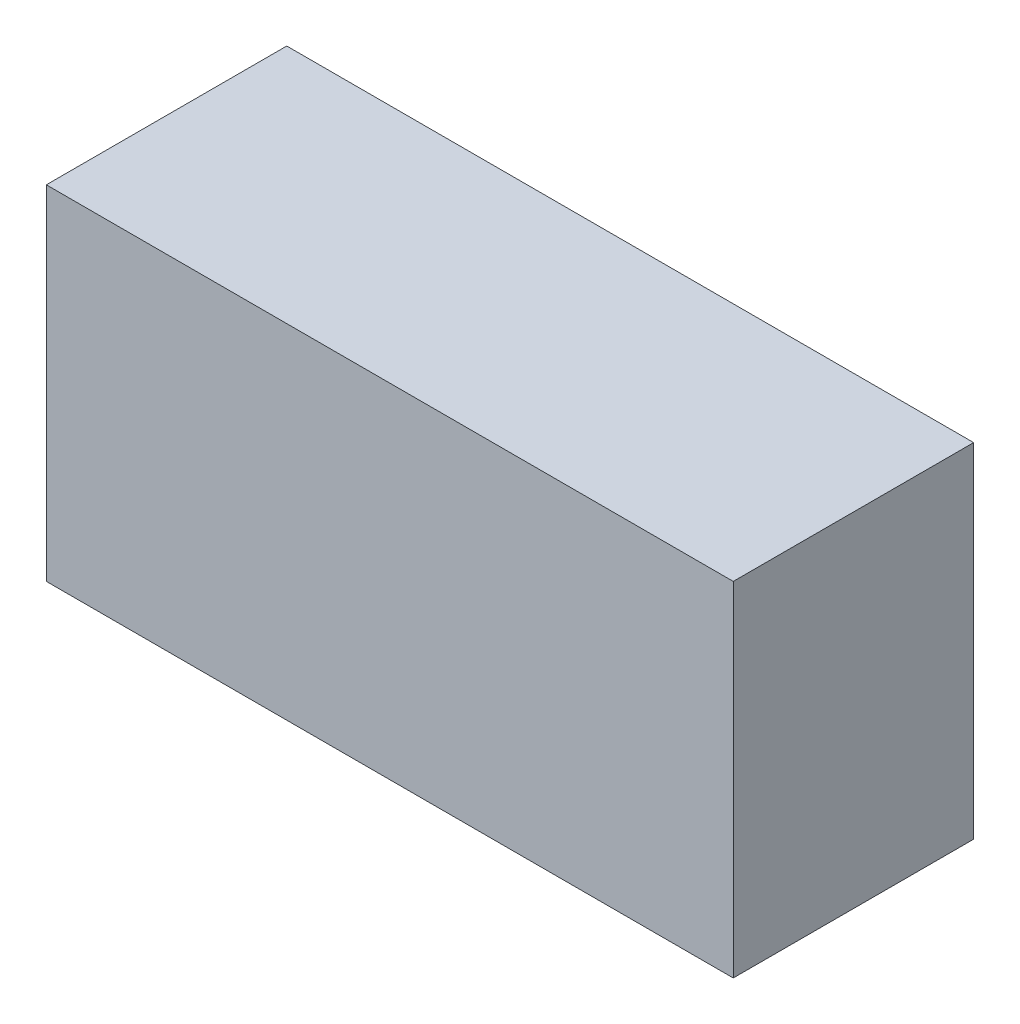
from build123d import *

# Parameters (mm, degrees)
SKETCH3_W           = 60
SKETCH3_H           = 30
BOSS_EXTRUDE1_DEPTH = 21


with BuildPart() as part:
    # Sketch3 → Boss-Extrude1 (new body)
    with BuildSketch(Plane.XY):
        Rectangle(SKETCH3_W, SKETCH3_H)
    extrude(amount=BOSS_EXTRUDE1_DEPTH)


solid = part.part
